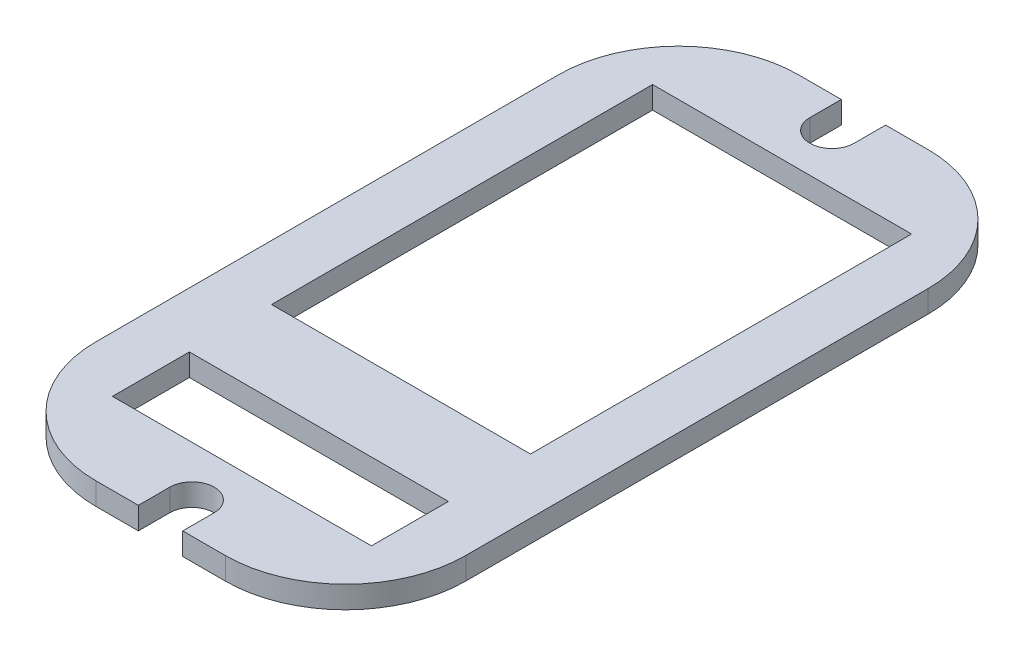
from build123d import *

# Parameters (mm, degrees)
SKETCH2_W           = 7
SKETCH2_H           = 10.3
SKETCH2_H_2         = 2.08
BOSS_EXTRUDE1_DEPTH = 0.6


with BuildPart() as part:
    # Sketch2 → Boss-Extrude1 (new body)
    with BuildSketch(Plane(origin=(0, 0, 0), x_dir=(1, 0, 0), z_dir=(0, 1, 0))):
        with BuildLine():
            Line((-0.6, 9.5), (-1.75, 9.5))
            ThreePointArc((-1.75, 9.5), (-4.048097039, 8.548097039), (-5, 6.25))
            Line((-5, 6.25), (-5, -6.25))
            ThreePointArc((-5, -6.25), (-4.048097039, -8.548097039), (-1.75, -9.5))
            Line((-1.75, -9.5), (-0.6, -9.5))
            Line((-0.6, -9.5), (-0.6, -8.65))
            ThreePointArc((-0.6, -8.65), (0, -8.05), (0.6, -8.65))
            Line((0.6, -8.65), (0.6, -9.5))
            Line((0.6, -9.5), (1.75, -9.5))
            ThreePointArc((1.75, -9.5), (4.048097039, -8.548097039), (5, -6.25))
            Line((5, -6.25), (5, 6.25))
            ThreePointArc((5, 6.25), (4.048097039, 8.548097039), (1.75, 9.5))
            Line((1.75, 9.5), (0.6, 9.5))
            Line((0.6, 9.5), (0.6, 8.65))
            ThreePointArc((0.6, 8.65), (0, 8.05), (-0.6, 8.65))
            Line((-0.6, 8.65), (-0.6, 9.5))
        make_face()
        with Locations((0, 2.15)):
            Rectangle(SKETCH2_W, SKETCH2_H, mode=Mode.SUBTRACT)
        with Locations((0, -6.26)):
            Rectangle(SKETCH2_W, SKETCH2_H_2, mode=Mode.SUBTRACT)
    extrude(amount=BOSS_EXTRUDE1_DEPTH)


solid = part.part
